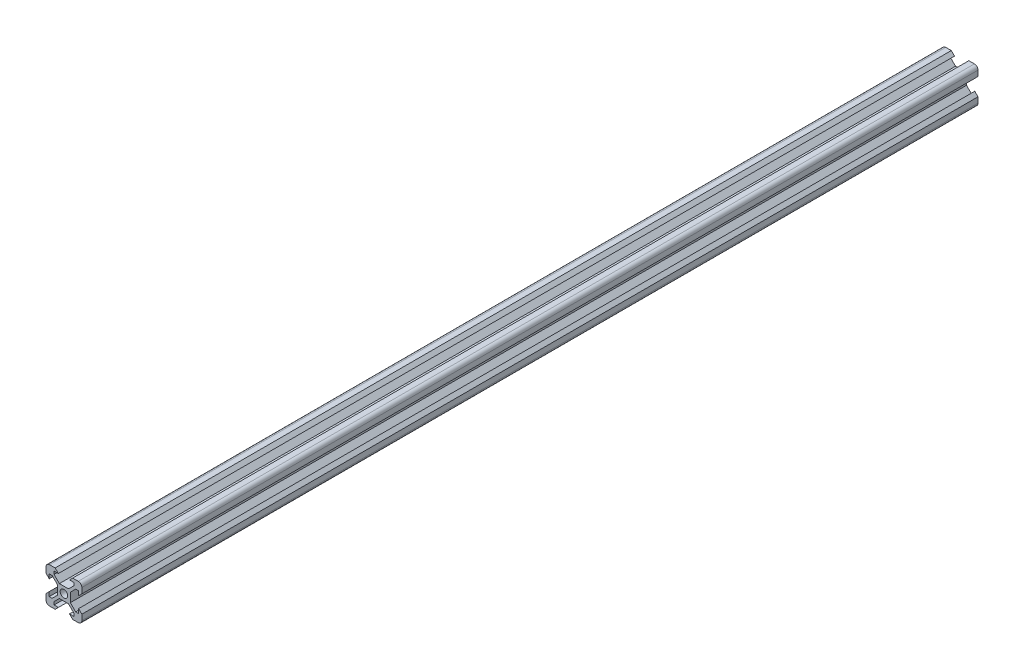
from build123d import *

# Parameters (mm, degrees)
SKETCH1_R           = 2.1
BOSS_EXTRUDE1_DEPTH = 500


with BuildPart() as part:
    # Sketch1 → Boss-Extrude1 (new body)
    with BuildSketch(Plane.XY):
        with BuildLine():
            Line((-4.9, -10), (-3.1, -8.2))
            Line((-3.1, -8.2), (-5.5, -8.2))
            Line((-5.5, -8.2), (-5.5, -6.560660172))
            Line((-5.5, -6.560660172), (-2.539339828, -3.6))
            Line((-2.539339828, -3.6), (2.539339828, -3.6))
            Line((2.539339828, -3.6), (5.5, -6.560660172))
            Line((5.5, -6.560660172), (5.5, -8.2))
            Line((5.5, -8.2), (3.1, -8.2))
            Line((3.1, -8.2), (4.9, -10))
            Line((4.9, -10), (8, -10))
            ThreePointArc((8, -10), (9.414213562, -9.414213562), (10, -8))
            Line((10, -8), (10, -4.9))
            Line((10, -4.9), (8.2, -3.1))
            Line((8.2, -3.1), (8.2, -5.5))
            Line((8.2, -5.5), (6.560660172, -5.5))
            Line((6.560660172, -5.5), (3.6, -2.539339828))
            Line((3.6, -2.539339828), (3.6, 2.539339828))
            Line((3.6, 2.539339828), (6.560660172, 5.5))
            Line((6.560660172, 5.5), (8.2, 5.5))
            Line((8.2, 5.5), (8.2, 3.1))
            Line((8.2, 3.1), (10, 4.9))
            Line((10, 4.9), (10, 8))
            ThreePointArc((10, 8), (9.414213562, 9.414213562), (8, 10))
            Line((8, 10), (4.9, 10))
            Line((4.9, 10), (3.1, 8.2))
            Line((3.1, 8.2), (5.5, 8.2))
            Line((5.5, 8.2), (5.5, 6.560660172))
            Line((5.5, 6.560660172), (2.539339828, 3.6))
            Line((2.539339828, 3.6), (-2.539339828, 3.6))
            Line((-2.539339828, 3.6), (-5.5, 6.560660172))
            Line((-5.5, 6.560660172), (-5.5, 8.2))
            Line((-5.5, 8.2), (-3.1, 8.2))
            Line((-3.1, 8.2), (-4.9, 10))
            Line((-4.9, 10), (-8, 10))
            ThreePointArc((-8, 10), (-9.414213562, 9.414213562), (-10, 8))
            Line((-10, 8), (-10, 4.9))
            Line((-10, 4.9), (-8.2, 3.1))
            Line((-8.2, 3.1), (-8.2, 5.5))
            Line((-8.2, 5.5), (-6.560660172, 5.5))
            Line((-6.560660172, 5.5), (-3.6, 2.539339828))
            Line((-3.6, 2.539339828), (-3.6, -2.539339828))
            Line((-3.6, -2.539339828), (-6.560660172, -5.5))
            Line((-6.560660172, -5.5), (-8.2, -5.5))
            Line((-8.2, -5.5), (-8.2, -3.1))
            Line((-8.2, -3.1), (-10, -4.9))
            Line((-10, -4.9), (-10, -8))
            ThreePointArc((-10, -8), (-9.414213562, -9.414213562), (-8, -10))
            Line((-8, -10), (-4.9, -10))
        make_face()
        Circle(SKETCH1_R, mode=Mode.SUBTRACT)
    extrude(amount=BOSS_EXTRUDE1_DEPTH)


solid = part.part
